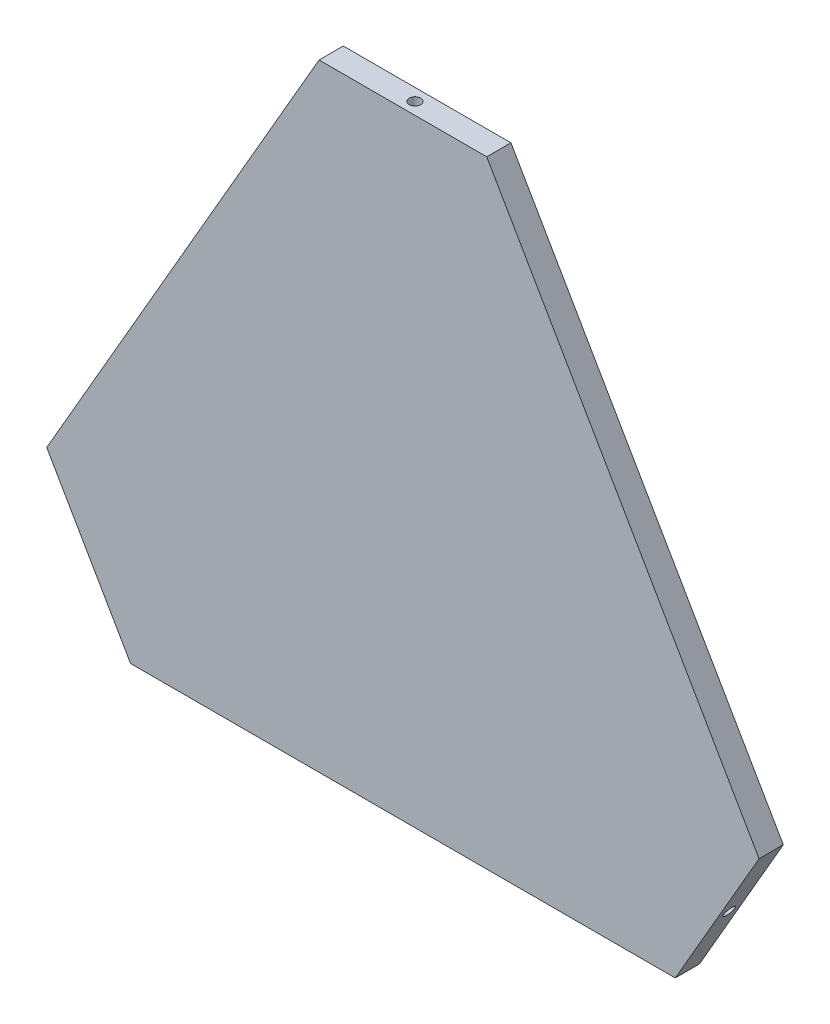
from build123d import *

# Parameters (mm, degrees)
BOSS_EXTRU_1_DEPTH      = 6.35
ENL_V_MAT_EXTRU_2_DEPTH = 232.027391955
ESQUISSE5_R             = 1.5
ENL_V_MAT_EXTRU_3_DEPTH = 5
ESQUISSE7_R             = 1.5
ENL_V_MAT_EXTRU_4_DEPTH = 5
ESQUISSE8_R             = 1.5
ENL_V_MAT_EXTRU_5_DEPTH = 5


with BuildPart() as part:
    # Esquisse2 → Boss.-Extru.1 (new body)
    with BuildSketch(Plane.XY):
        Polygon((-115.470053838, 0), (115.470053838, 0), (0, 200), align=None)
    extrude(amount=BOSS_EXTRU_1_DEPTH)

    # Esquisse4 → Enlèv. mat.-Extru.2 (cut, through all)
    with BuildSketch(Plane.XY.offset(6.35)):
        Polygon((-115.470053838, 0), (-93.470053838, 38.105117767), (-71.470053838, 0), align=None)
        Polygon((115.470053838, 0), (71.470053838, 0), (93.470053838, 38.105117767), align=None)
        Polygon((0, 200), (-22, 161.894882233), (22, 161.894882233), align=None)
    extrude(amount=-ENL_V_MAT_EXTRU_2_DEPTH, mode=Mode.SUBTRACT)

    # Esquisse5 → Enlèv. mat.-Extru.3 (cut)
    with BuildSketch(Plane(origin=(-53.602540378, -30.947441117, 0), x_dir=(0, 0, 1), z_dir=(-0.8660254037844389, -0.49999999999999983, 0))):
        with Locations(Location((3.175, 57.735026919, 0), (0, 0, 270))):
            Circle(ESQUISSE5_R)
    extrude(amount=-ENL_V_MAT_EXTRU_3_DEPTH, mode=Mode.SUBTRACT)

    # Esquisse7 → Enlèv. mat.-Extru.4 (cut)
    with BuildSketch(Plane(origin=(0, 161.894882233, 0), x_dir=(1, 0, 0), z_dir=(0, 1, 0))):
        with Locations(Location((0, -3.175, 0), (0, 0, 270))):
            Circle(ESQUISSE7_R)
    extrude(amount=-ENL_V_MAT_EXTRU_4_DEPTH, mode=Mode.SUBTRACT)

    # Esquisse8 → Enlèv. mat.-Extru.5 (cut)
    with BuildSketch(Plane(origin=(53.602540378, -30.947441117, 0), x_dir=(0, 0, -1), z_dir=(0.8660254037844383, -0.5000000000000009, 0))):
        with Locations(Location((-3.175, 57.735026919, 0), (0, 0, 90))):
            Circle(ESQUISSE8_R)
    extrude(amount=-ENL_V_MAT_EXTRU_5_DEPTH, mode=Mode.SUBTRACT)


solid = part.part
